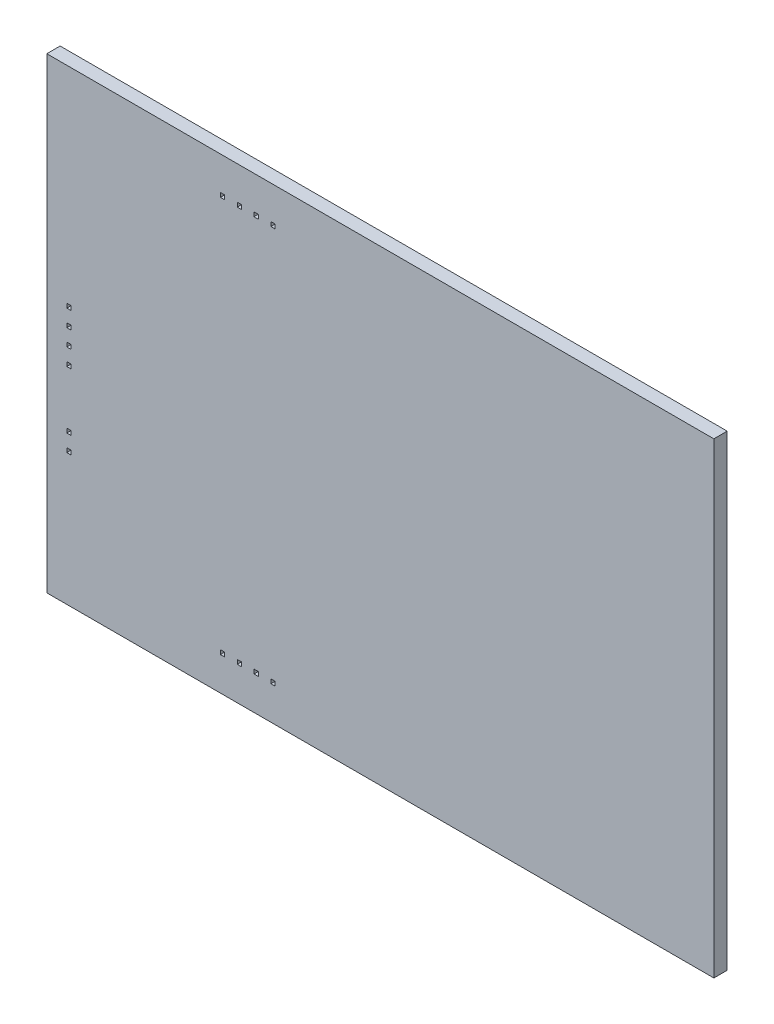
from build123d import *

# Parameters (mm, degrees)
CROQUIS1_W              = 130
CROQUIS1_H              = 70
SALIENTE_EXTRUIR1_DEPTH = 2
CROQUIS2_W              = 30
CROQUIS2_H              = 70
CORTAR_EXTRUIR1_DEPTH   = 148.66177569
CROQUIS3_W              = 0.64
CROQUIS3_H              = 0.64
CORTAR_EXTRUIR2_DEPTH   = 123.081939696


with BuildPart() as part:
    # Croquis1 → Saliente-Extruir1 (new body)
    with BuildSketch(Plane.XY):
        with Locations((65, 35)):
            Rectangle(CROQUIS1_W, CROQUIS1_H)
    extrude(amount=SALIENTE_EXTRUIR1_DEPTH)

    # Croquis2 → Cortar-Extruir1 (cut, through all)
    with BuildSketch(Plane(origin=(0, 0, 0), x_dir=(-1, 0, 0), z_dir=(0, 0, -1))):
        with Locations((-115, 35)):
            Rectangle(CROQUIS2_W, CROQUIS2_H)
    extrude(amount=-CORTAR_EXTRUIR1_DEPTH, mode=Mode.SUBTRACT)

    # Croquis3 → Cortar-Extruir2 (cut, through all)
    with BuildSketch(Plane(origin=(0, 0, 0), x_dir=(-1, 0, 0), z_dir=(0, 0, -1))):
        with Locations((-3.32, 36.25)):
            Rectangle(CROQUIS3_W, CROQUIS3_H)
        with Locations((-3.32, 31.21)):
            Rectangle(CROQUIS3_W, CROQUIS3_H)
        with Locations((-3.32, 38.79)):
            Rectangle(CROQUIS3_W, CROQUIS3_H)
        with Locations((-3.32, 33.75)):
            Rectangle(CROQUIS3_W, CROQUIS3_H)
        with Locations((-28.88, 5.32)):
            Rectangle(CROQUIS3_W, CROQUIS3_H)
        with Locations((-33.92, 5.32)):
            Rectangle(CROQUIS3_W, CROQUIS3_H)
        with Locations((-26.34, 5.32)):
            Rectangle(CROQUIS3_W, CROQUIS3_H)
        with Locations((-31.38, 5.32)):
            Rectangle(CROQUIS3_W, CROQUIS3_H)
        with Locations((-33.92, 64.68)):
            Rectangle(CROQUIS3_W, CROQUIS3_H)
        with Locations((-31.38, 64.68)):
            Rectangle(CROQUIS3_W, CROQUIS3_H)
        with Locations((-26.34, 64.68)):
            Rectangle(CROQUIS3_W, CROQUIS3_H)
        with Locations((-28.88, 64.68)):
            Rectangle(CROQUIS3_W, CROQUIS3_H)
        with Locations((-3.32, 20.03)):
            Rectangle(CROQUIS3_W, CROQUIS3_H)
        with Locations((-3.32, 22.57)):
            Rectangle(CROQUIS3_W, CROQUIS3_H)
    extrude(amount=-CORTAR_EXTRUIR2_DEPTH, mode=Mode.SUBTRACT)


solid = part.part
